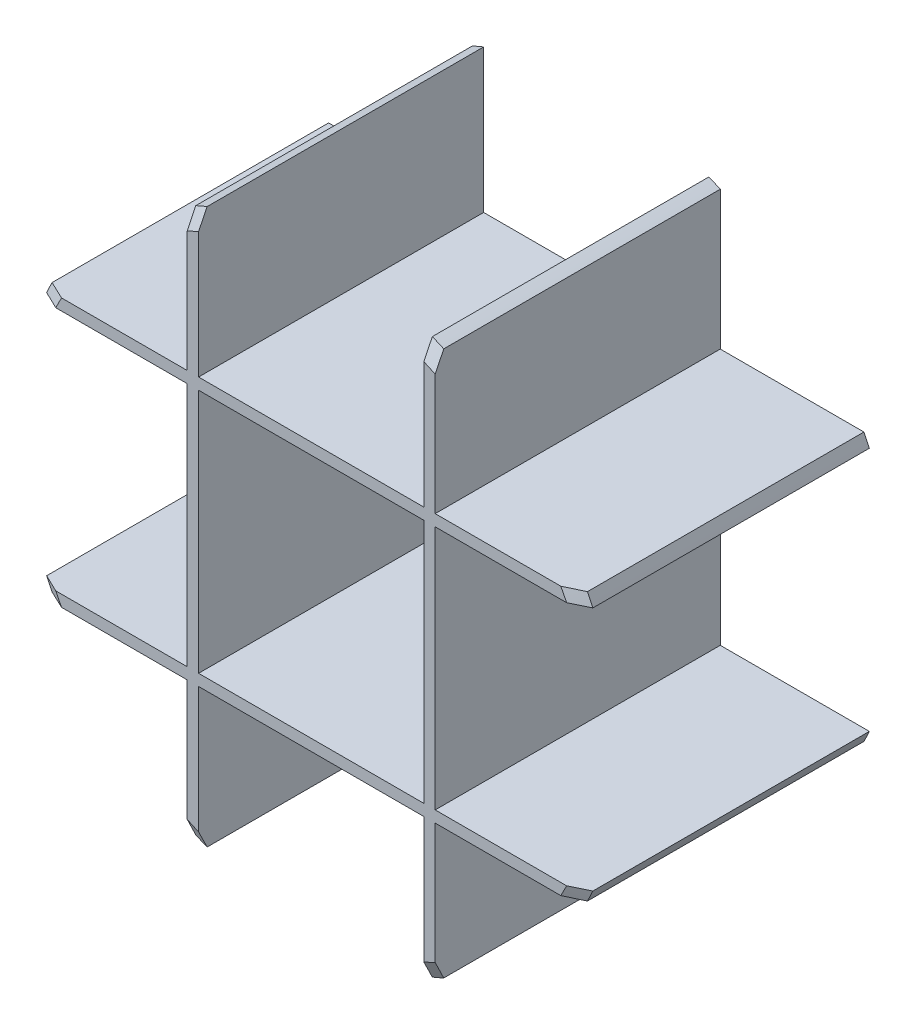
from build123d import *

# Parameters (mm, degrees)
SKETCH1_W           = 39.5
SKETCH1_H           = 43
BOSS_EXTRUDE1_DEPTH = 50


with BuildPart() as part:
    # Sketch1 → Boss-Extrude1 (new body)
    with BuildSketch(Plane.XY):
        with BuildLine():
            Line((-19.75, 48.643473355), (-19.75, 23.5))
            Line((-19.75, 23.5), (19.75, 23.5))
            Line((19.75, 23.5), (19.75, 48.643473355))
            ThreePointArc((19.75, 48.643473355), (20.754462841, 48.223461844), (21.75, 47.782711309))
            Line((21.75, 47.782711309), (21.75, 23.5))
            Line((21.75, 23.5), (46.946778377, 23.5))
            ThreePointArc((46.946778377, 23.5), (47.431791843, 22.505002168), (47.895720059, 21.5))
            Line((47.895720059, 21.5), (21.75, 21.5))
            Line((21.75, 21.5), (21.75, -21.5))
            Line((21.75, -21.5), (47.895720059, -21.5))
            ThreePointArc((47.895720059, -21.5), (47.431791843, -22.505002168), (46.946778377, -23.5))
            Line((46.946778377, -23.5), (21.75, -23.5))
            Line((21.75, -23.5), (21.75, -47.782711309))
            ThreePointArc((21.75, -47.782711309), (20.754462841, -48.223461844), (19.75, -48.643473355))
            Line((19.75, -48.643473355), (19.75, -23.5))
            Line((19.75, -23.5), (-19.75, -23.5))
            Line((-19.75, -23.5), (-19.75, -48.643473355))
            ThreePointArc((-19.75, -48.643473355), (-20.754462841, -48.223461844), (-21.75, -47.782711309))
            Line((-21.75, -47.782711309), (-21.75, -23.5))
            Line((-21.75, -23.5), (-46.946778377, -23.5))
            ThreePointArc((-46.946778377, -23.5), (-47.431791843, -22.505002168), (-47.895720059, -21.5))
            Line((-47.895720059, -21.5), (-21.75, -21.5))
            Line((-21.75, -21.5), (-21.75, 21.5))
            Line((-21.75, 21.5), (-47.895720059, 21.5))
            ThreePointArc((-47.895720059, 21.5), (-47.431791843, 22.505002168), (-46.946778377, 23.5))
            Line((-46.946778377, 23.5), (-21.75, 23.5))
            Line((-21.75, 23.5), (-21.75, 47.782711309))
            ThreePointArc((-21.75, 47.782711309), (-20.754462841, 48.223461844), (-19.75, 48.643473355))
        make_face()
        Rectangle(SKETCH1_W, SKETCH1_H, mode=Mode.SUBTRACT)
    extrude(amount=BOSS_EXTRUDE1_DEPTH)

    # Sketch2 → Cut-Revolve1 (revolve, cut)
    with BuildSketch(Plane(origin=(0, 0, 0), x_dir=(1, 0, 0), z_dir=(0, 1, 0))):
        Polygon((-52.5, -48.5), (-23.44, -64), (0, -64), (0, -76.924912946), (-62.730842365, -76.924912946), (-62.730842365, -48.5), align=None)
    revolve(axis=Axis((0, 0, -17.212629341), (0, 0, 1)), mode=Mode.SUBTRACT)


solid = part.part
